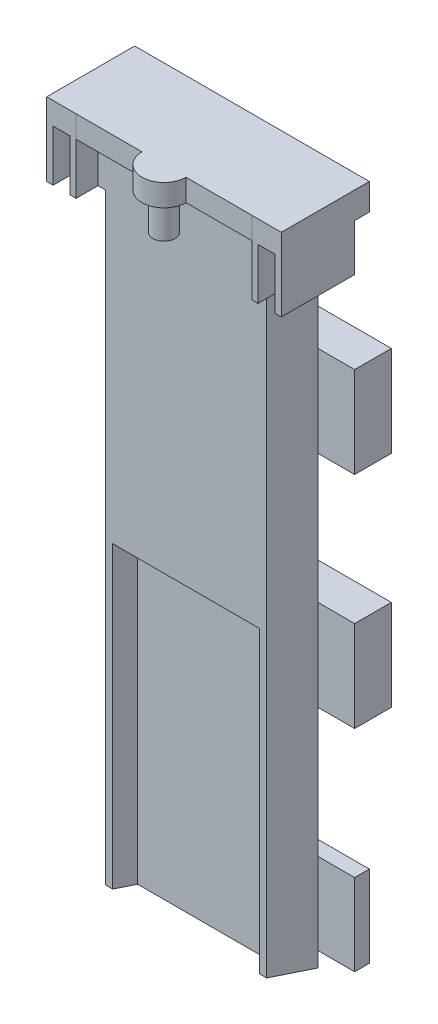
from build123d import *

# Parameters (mm, degrees)
SKETCH2_W            = 14
SKETCH2_H            = 48
BOSS_EXTRUDE1_DEPTH  = 8
SKETCH3_W            = 10
SKETCH3_H            = 3.5
CUT_EXTRUDE1_DEPTH   = 51.635955605
CUT_EXTRUDE4_DEPTH   = 48
CUT_EXTRUDE5_REACH   = 51.933
SKETCH16_W           = 1.002160824
SKETCH16_H           = 48
BOSS_EXTRUDE4_DEPTH  = 1
SKETCH17_W           = 1.002160824
SKETCH17_H           = 48
BOSS_EXTRUDE5_DEPTH  = 1
SKETCH25_W           = 2
SKETCH25_H           = 5
BOSS_EXTRUDE10_DEPTH = 5
SKETCH26_W           = 12
SKETCH26_H           = 1.5
BOSS_EXTRUDE11_DEPTH = 1.5
SKETCH27_R           = 1.5
BOSS_EXTRUDE14_DEPTH = 1.5
SKETCH29_R           = 0.75
CUT_EXTRUDE12_DEPTH  = 1.5
SKETCH30_W           = 1.15
SKETCH30_H           = 3.49
CUT_EXTRUDE13_DEPTH  = 5
SKETCH32_W           = 10
SKETCH32_H           = 47.172433363
BOSS_EXTRUDE15_DEPTH = 3.5
BOSS_EXTRUDE16_DEPTH = 10
SKETCH34_W           = 10
SKETCH34_H           = 20.2
CUT_EXTRUDE15_DEPTH  = 1.7
SKETCH35_W           = 10
SKETCH35_H           = 1.7
CUT_EXTRUDE16_DEPTH  = 1
CUT_EXTRUDE18_START  = -16
SKETCH38_W           = 1.002160824
SKETCH38_H           = 8.4
SKETCH38_H_2         = 8.398563286
CUT_EXTRUDE18_DEPTH  = 16
CUT_EXTRUDE19_DEPTH  = 20
SKETCH43_W           = 16
SKETCH43_H           = 1.002160824
CUT_EXTRUDE20_DEPTH  = 0.4
SKETCH44_W           = 16
SKETCH44_H           = 1.002160824
CUT_EXTRUDE21_DEPTH  = 0.4
SKETCH45_W           = 16
SKETCH45_H           = 1.002160824
CUT_EXTRUDE22_DEPTH  = 0.4
SKETCH46_R           = 0.75
BOSS_EXTRUDE18_DEPTH = 4
SKETCH47_W           = 10
SKETCH47_H           = 1.7
CUT_EXTRUDE23_DEPTH  = 1
CUT_EXTRUDE24_DEPTH  = 0.5
CUT_EXTRUDE25_DEPTH  = 0.5
CUT_EXTRUDE26_DEPTH  = 52.14944604
SKETCH51_W           = 16
SKETCH51_H           = 6.2
BOSS_EXTRUDE19_DEPTH = 2
SKETCH52_W           = 0.5
SKETCH52_H           = 6.2
CUT_EXTRUDE27_DEPTH  = 16
SKETCH53_W           = 0.5
SKETCH53_H           = 6.2
CUT_EXTRUDE28_DEPTH  = 16


with BuildPart() as part:
    # Sketch2 → Boss-Extrude1 (new body)
    with BuildSketch(Plane.XY):
        with Locations((-7, 24)):
            Rectangle(SKETCH2_W, SKETCH2_H)
    extrude(amount=BOSS_EXTRUDE1_DEPTH)

    # Sketch3 → Cut-Extrude1 (cut, through all)
    with BuildSketch(Plane(origin=(0, 0, 0), x_dir=(-1, 0, 0), z_dir=(0, -1, 0))):
        with Locations((7, -1.75)):
            Rectangle(SKETCH3_W, SKETCH3_H)
    extrude(amount=-CUT_EXTRUDE1_DEPTH, mode=Mode.SUBTRACT)

    # Sketch7 → Cut-Extrude4 (cut)
    with BuildSketch(Plane.XZ):
        Polygon((-14, 1.002160824), (-13, 1.002160824), (-13, 4.501055273), (-1, 4.501055273), (-1, 1.002160824), (0, 1.002160824), (0, 8), (-14, 8), align=None)
    extrude(amount=-CUT_EXTRUDE4_DEPTH, mode=Mode.SUBTRACT)

    # Cut-Extrude5: up to this face of the body (flat: up to its plane)
    cut_extrude5_end = Plane(part.part.faces().sort_by_distance((-1, 24, 2.751608048))[0])
    # Sketch9 → Cut-Extrude5 (cut, up to the picked face)
    with BuildSketch(Plane.ZY.offset(13), mode=Mode.PRIVATE) as cut_extrude5_sk1:
        Polygon((1.002160824, 0), (4.501055273, 1.159229281), (4.501055273, 0), align=None)
    cut_extrude5_tool1 = split(extrude(cut_extrude5_sk1.sketch, amount=-CUT_EXTRUDE5_REACH, mode=Mode.PRIVATE), bisect_by=cut_extrude5_end, keep=Keep.BOTH, mode=Mode.PRIVATE)
    add(cut_extrude5_tool1.solids().sort_by(Axis((-13, 0.38641, 3.334757), (1, 0, 0)))[0], mode=Mode.SUBTRACT)

    # Sketch16 → Boss-Extrude4 (add)
    with BuildSketch(Plane(origin=(0, 0, 0), x_dir=(0, 0, -1), z_dir=(1, 0, 0))):
        with Locations((-0.501080412, 24)):
            Rectangle(SKETCH16_W, SKETCH16_H)
    extrude(amount=BOSS_EXTRUDE4_DEPTH)

    # Sketch17 → Boss-Extrude5 (add)
    with BuildSketch(Plane.ZY.offset(14)):
        with Locations((0.501080412, 24)):
            Rectangle(SKETCH17_W, SKETCH17_H)
    extrude(amount=BOSS_EXTRUDE5_DEPTH)

    # Sketch25 → Boss-Extrude10 (add)
    with BuildSketch(Plane.XY.offset(1.002160824)):
        with Locations((0, 45.5)):
            Rectangle(SKETCH25_W, SKETCH25_H)
        with Locations((-14, 45.5)):
            Rectangle(SKETCH25_W, SKETCH25_H)
    extrude(amount=BOSS_EXTRUDE10_DEPTH)

    # Sketch26 → Boss-Extrude11 (add)
    with BuildSketch(Plane.XY.offset(4.501055273)):
        with Locations((-7, 47.25)):
            Rectangle(SKETCH26_W, SKETCH26_H)
    extrude(amount=BOSS_EXTRUDE11_DEPTH)

    # Sketch27 → Boss-Extrude14 (add)
    with BuildSketch(Plane(origin=(0, 48, 0), x_dir=(1, 0, 0), z_dir=(0, 1, 0))):
        with Locations((-7.000000094, -6.001055273)):
            Circle(SKETCH27_R)
    extrude(amount=-BOSS_EXTRUDE14_DEPTH)

    # Sketch29 → Cut-Extrude12 (cut)
    with BuildSketch(Plane(origin=(0, 48, 0), x_dir=(1, 0, 0), z_dir=(0, 1, 0))):
        with Locations(Location((-7.000000094, -6.001055273, 0), (0, 0, 270))):
            Circle(SKETCH29_R)
    extrude(amount=-CUT_EXTRUDE12_DEPTH, mode=Mode.SUBTRACT)

    # Sketch30 → Cut-Extrude13 (cut)
    with BuildSketch(Plane.XY.offset(6.002160824)):
        with Locations((-13.985, 44.745)):
            Rectangle(SKETCH30_W, SKETCH30_H)
        with Locations((-0.015, 44.745)):
            Rectangle(SKETCH30_W, SKETCH30_H)
    extrude(amount=-CUT_EXTRUDE13_DEPTH, mode=Mode.SUBTRACT)

    # Sketch32 → Boss-Extrude15 (add)
    with BuildSketch(Plane(origin=(0, 0, 3.5), x_dir=(-1, 0, 0), z_dir=(0, 0, -1))):
        with Locations((7, 24.413783318)):
            Rectangle(SKETCH32_W, SKETCH32_H)
    extrude(amount=BOSS_EXTRUDE15_DEPTH)

    # Sketch33 → Boss-Extrude16 (add)
    with BuildSketch(Plane(origin=(-12, 0, 0), x_dir=(0, 0, -1), z_dir=(1, 0, 0))):
        Polygon((-3.5, 0.827566637), (0, 0.827566637), (0, -0.332028927), align=None)
    extrude(amount=BOSS_EXTRUDE16_DEPTH)

    # Sketch34 → Cut-Extrude15 (cut)
    with BuildSketch(Plane.XY.offset(4.501055273)):
        with Locations((-7, 11.259229281)):
            Rectangle(SKETCH34_W, SKETCH34_H)
    extrude(amount=-CUT_EXTRUDE15_DEPTH, mode=Mode.SUBTRACT)

    # Sketch35 → Cut-Extrude16 (cut)
    with BuildSketch(Plane(origin=(0, 1.159229281, 0), x_dir=(1, 0, 0), z_dir=(0, 1, 0))):
        with Locations((-7, -3.651055273)):
            Rectangle(SKETCH35_W, SKETCH35_H)
    extrude(amount=-CUT_EXTRUDE16_DEPTH, mode=Mode.SUBTRACT)

    # Sketch38 → Cut-Extrude18 (cut)
    with BuildSketch(Plane(origin=(1, 0, 0), x_dir=(0, 0, -1), z_dir=(1, 0, 0)).offset(CUT_EXTRUDE18_START)):
        with Locations((-0.501080412, 11.591582536)):
            Rectangle(SKETCH38_W, SKETCH38_H)
        with Locations((-0.501080412, 26.591582536)):
            Rectangle(SKETCH38_W, SKETCH38_H)
        with Locations((-0.501080412, 41.590864179)):
            Rectangle(SKETCH38_W, SKETCH38_H_2)
    extrude(amount=CUT_EXTRUDE18_DEPTH, mode=Mode.SUBTRACT)

    # Sketch40 → Cut-Extrude19 (cut)
    with BuildSketch(Plane.ZY.offset(15)):
        Polygon((4.501055273, 1.159229281), (0, -0.332028927), (0, 0.467971073), (4.501055273, 1.959229281), align=None)
    extrude(amount=-CUT_EXTRUDE19_DEPTH, mode=Mode.SUBTRACT)

    # Sketch43 → Cut-Extrude20 (cut)
    with BuildSketch(Plane.XZ.offset(-45.790145822)):
        with Locations((-7, 0.501080412)):
            Rectangle(SKETCH43_W, SKETCH43_H)
    extrude(amount=-CUT_EXTRUDE20_DEPTH, mode=Mode.SUBTRACT)

    # Sketch44 → Cut-Extrude21 (cut)
    with BuildSketch(Plane(origin=(0, 30.791582536, 0), x_dir=(-1, 0, 0), z_dir=(0, -1, 0))):
        with Locations((7, -0.501080412)):
            Rectangle(SKETCH44_W, SKETCH44_H)
    extrude(amount=-CUT_EXTRUDE21_DEPTH, mode=Mode.SUBTRACT)

    # Sketch45 → Cut-Extrude22 (cut)
    with BuildSketch(Plane.XZ.offset(-15.791582536)):
        with Locations((-7, 0.501080412)):
            Rectangle(SKETCH45_W, SKETCH45_H)
    extrude(amount=-CUT_EXTRUDE22_DEPTH, mode=Mode.SUBTRACT)

    # Sketch46 → Boss-Extrude18 (add)
    with BuildSketch(Plane(origin=(0, 48, 0), x_dir=(1, 0, 0), z_dir=(0, 1, 0))):
        with Locations(Location((-7.000000094, -6.001055273, 0), (0, 0, 270))):
            Circle(SKETCH46_R)
    extrude(amount=-BOSS_EXTRUDE18_DEPTH)

    # Sketch47 → Cut-Extrude23 (cut)
    with BuildSketch(Plane.XZ.offset(-21.359229281)):
        with Locations((-7, 3.651055273)):
            Rectangle(SKETCH47_W, SKETCH47_H)
    extrude(amount=-CUT_EXTRUDE23_DEPTH, mode=Mode.SUBTRACT)

    # Sketch48 → Cut-Extrude24 (cut)
    with BuildSketch(Plane(origin=(-1, 0, 0), x_dir=(0, 0, -1), z_dir=(1, 0, 0))):
        Polygon((-4.501055273, 1.959229281), (-1.002160824, 0.8), (-1.002160824, 43), (-4.501055273, 43), align=None)
    extrude(amount=-CUT_EXTRUDE24_DEPTH, mode=Mode.SUBTRACT)

    # Sketch49 → Cut-Extrude25 (cut)
    with BuildSketch(Plane.ZY.offset(13)):
        Polygon((1.002160824, 0.8), (4.501055273, 1.959229281), (4.501055273, 43), (1.002160824, 43), align=None)
    extrude(amount=-CUT_EXTRUDE25_DEPTH, mode=Mode.SUBTRACT)

    # Sketch50 → Cut-Extrude26 (cut, through all)
    with BuildSketch(Plane(origin=(1, 0, 0), x_dir=(0, 0, -1), z_dir=(1, 0, 0))):
        Polygon((-1.002160824, 0.8), (0, 0.467971073), (0, 1.826644399), (-1.002160824, 1.826644399), align=None)
    extrude(amount=-CUT_EXTRUDE26_DEPTH, mode=Mode.SUBTRACT)

    # Sketch51 → Boss-Extrude19 (add)
    with BuildSketch(Plane(origin=(0, 0, 0), x_dir=(-1, 0, 0), z_dir=(0, 0, -1))):
        with Locations((7, 19.291582536)):
            Rectangle(SKETCH51_W, SKETCH51_H)
        with Locations((7, 34.291582536)):
            Rectangle(SKETCH51_W, SKETCH51_H)
    extrude(amount=BOSS_EXTRUDE19_DEPTH)

    # Sketch52 → Cut-Extrude27 (cut)
    with BuildSketch(Plane(origin=(1, 0, 0), x_dir=(0, 0, -1), z_dir=(1, 0, 0))):
        with Locations((1.75, 19.291582536)):
            Rectangle(SKETCH52_W, SKETCH52_H)
    extrude(amount=-CUT_EXTRUDE27_DEPTH, mode=Mode.SUBTRACT)

    # Sketch53 → Cut-Extrude28 (cut)
    with BuildSketch(Plane(origin=(1, 0, 0), x_dir=(0, 0, -1), z_dir=(1, 0, 0))):
        with Locations((1.75, 34.291582536)):
            Rectangle(SKETCH53_W, SKETCH53_H)
    extrude(amount=-CUT_EXTRUDE28_DEPTH, mode=Mode.SUBTRACT)


solid = part.part
